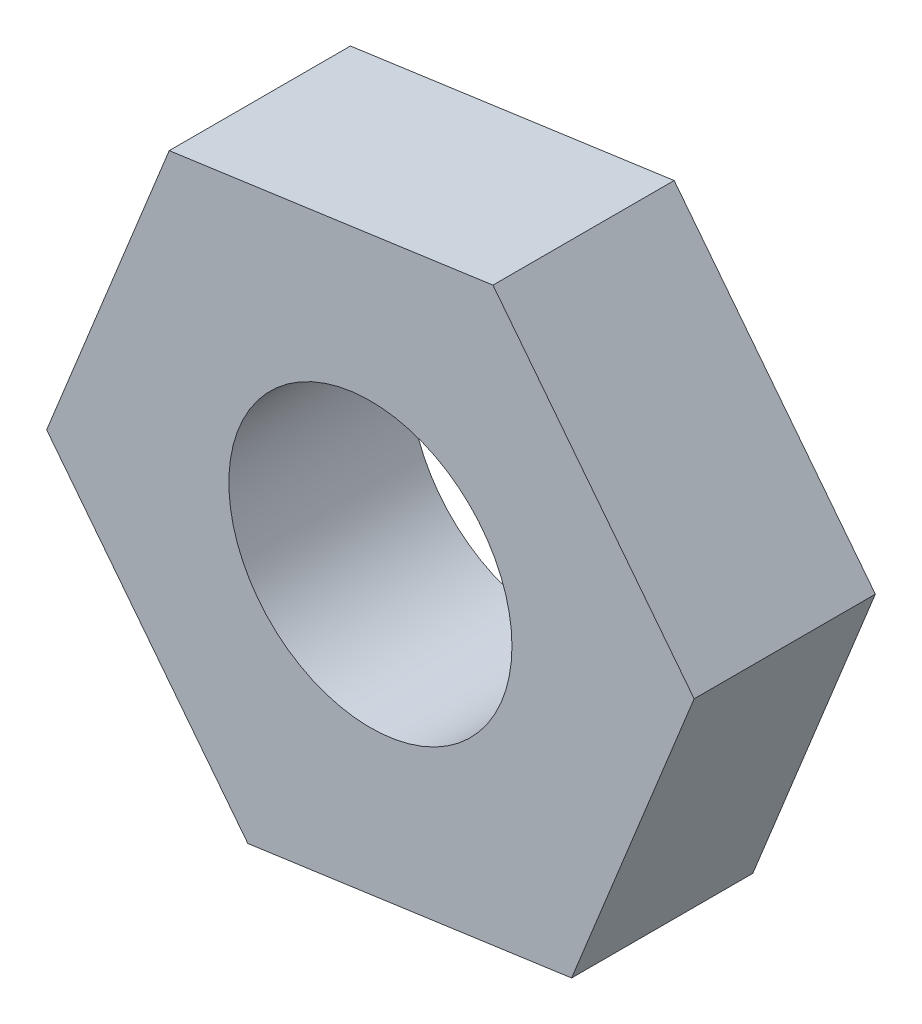
from build123d import *

# Parameters (mm, degrees)
CROQUIS1_R   = 1.5875
TUERCA_DEPTH = 2.032


with BuildPart() as part:
    # Croquis1 → TUERCA (new body)
    with BuildSketch(Plane.XY):
        Polygon((-3.630663104, -0.509037091), (-1.3744925, -3.398765026), (2.256170604, -2.889727935), (3.630663104, 0.509037091), (1.3744925, 3.398765026), (-2.256170604, 2.889727935), align=None)
        Circle(CROQUIS1_R, mode=Mode.SUBTRACT)
    extrude(amount=TUERCA_DEPTH)


solid = part.part
